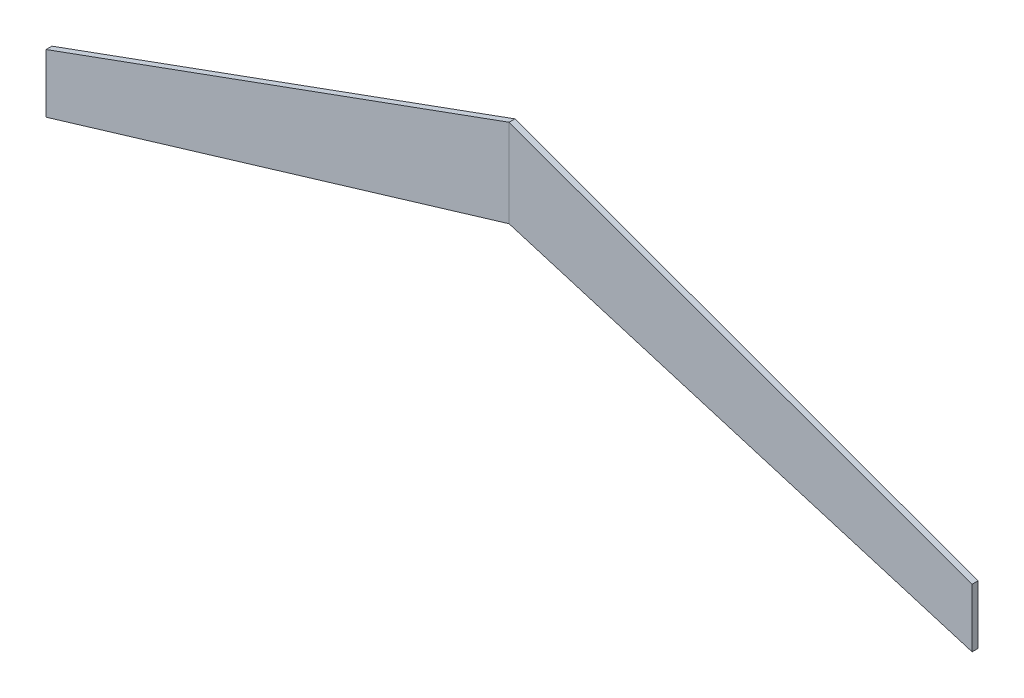
from build123d import *

# Parameters (mm, degrees)
BOSS_EXTRUDE1_DEPTH = 4


with BuildPart() as part:
    # Sketch1 → Boss-Extrude1 (new body)
    with BuildSketch(Plane.XY):
        Polygon((0, 60), (0, 0), (316, -95.014594028), (316, -55.014594028), align=None)
    extrude(amount=BOSS_EXTRUDE1_DEPTH)


with BuildPart() as body_2:
    # Mirror1: mirrored copy
    add(part.part.mirror(Plane(origin=(0, 0, 0), x_dir=(0, 0, 1), z_dir=(1, 0, 0))))


solid = Compound([part.part, body_2.part])
